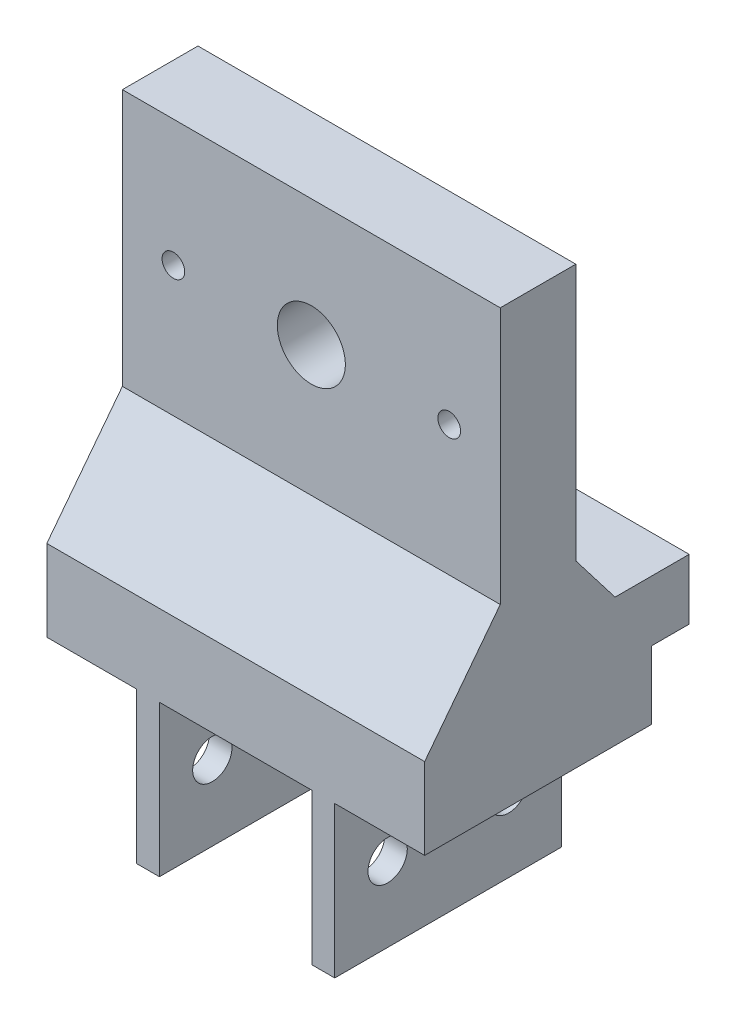
from build123d import *

# Parameters (mm, degrees)
EXTRUDE_1_DEPTH     = 30
SKETCH_2_W          = 50
SKETCH_2_H          = 10
EXTRUDE_2_DEPTH     = 50
HOLE_WIZARD_2_D     = 5.2
HOLE_WIZARD_3_D     = 9
SKETCH_17_R         = 2.45
EXTRUDE_6_DEPTH     = 4
HOLE_WIZARD_5_D     = 3
EXTRUDE_7_DEPTH     = 50
SKETCH_21_W         = 10
SKETCH_21_H         = 3
CUT_EXTRUDE_1_DEPTH = 81.413870849
SKETCH_23_W         = 9.807692308
SKETCH_23_H         = 8
EXTRUDE_8_DEPTH     = 50


with BuildPart() as part:
    # 草图1 → 凸台-拉伸1 (new body)
    with BuildSketch(Plane.XY):
        Polygon((13.1, -5.375), (13.1, -25.375), (10.1, -25.375), (10.1, -5.375), (-10.1, -5.375), (-10.1, -25.375), (-13.1, -25.375), (-13.1, -5.375), (-25, -5.375), (-25, 5.375), (25, 5.375), (25, -5.375), align=None)
    extrude(amount=EXTRUDE_1_DEPTH)

    # 草图2 → 凸台-拉伸2 (add)
    with BuildSketch(Plane(origin=(0, 5.375, 0), x_dir=(1, 0, 0), z_dir=(0, 1, 0))):
        with Locations((0, -15)):
            Rectangle(SKETCH_2_W, SKETCH_2_H)
    extrude(amount=EXTRUDE_2_DEPTH)

    # 孔2 (through all)
    with Locations(Plane.ZY.offset(13.1)):
        with Locations((7, -15.375), (23, -15.375)):
            Hole(HOLE_WIZARD_2_D / 2)

    # 孔3 (through all)
    with Locations(Plane(origin=(0, 0, 10), x_dir=(-1, 0, 0), z_dir=(0, 0, -1))):
        with Locations((0, 35.625)):
            Hole(HOLE_WIZARD_3_D / 2)

    # 草图17 → 凸台-拉伸6 (add)
    with BuildSketch(Plane(origin=(0, 0, 10), x_dir=(-1, 0, 0), z_dir=(0, 0, -1))):
        with Locations(Location((18.25, 35.625, 0), (0, 0, 180))):
            Circle(SKETCH_17_R)
        with Locations(Location((-18.25, 35.625, 0), (0, 0, 180))):
            Circle(SKETCH_17_R)
    extrude(amount=EXTRUDE_6_DEPTH)

    # 孔5 (through all)
    with Locations(Plane(origin=(0, 0, 6), x_dir=(-1, 0, 0), z_dir=(0, 0, -1))):
        with Locations((18.25, 35.625), (-18.25, 35.625)):
            Hole(HOLE_WIZARD_5_D / 2)

    # 草图20 → 凸台-拉伸7 (add)
    with BuildSketch(Plane.ZY.offset(25)):
        Polygon((20, 18.375), (30, 5.375), (20, 5.375), align=None)
        Polygon((10, 18.375), (0, 5.375), (10, 5.375), align=None)
    extrude(amount=-EXTRUDE_7_DEPTH)

    # 草图21 → 切除-拉伸1 (cut, through all)
    with BuildSketch(Plane.ZY.offset(25)):
        with Locations((15, 53.875)):
            Rectangle(SKETCH_21_W, SKETCH_21_H)
    extrude(amount=-CUT_EXTRUDE_1_DEPTH, mode=Mode.SUBTRACT)

    # 草图23 → 凸台-拉伸8 (add)
    with BuildSketch(Plane(origin=(25, 0, 0), x_dir=(0, 0, -1), z_dir=(1, 0, 0))):
        with Locations((0.096153846, 7.625)):
            Rectangle(SKETCH_23_W, SKETCH_23_H)
    extrude(amount=-EXTRUDE_8_DEPTH)


solid = part.part
